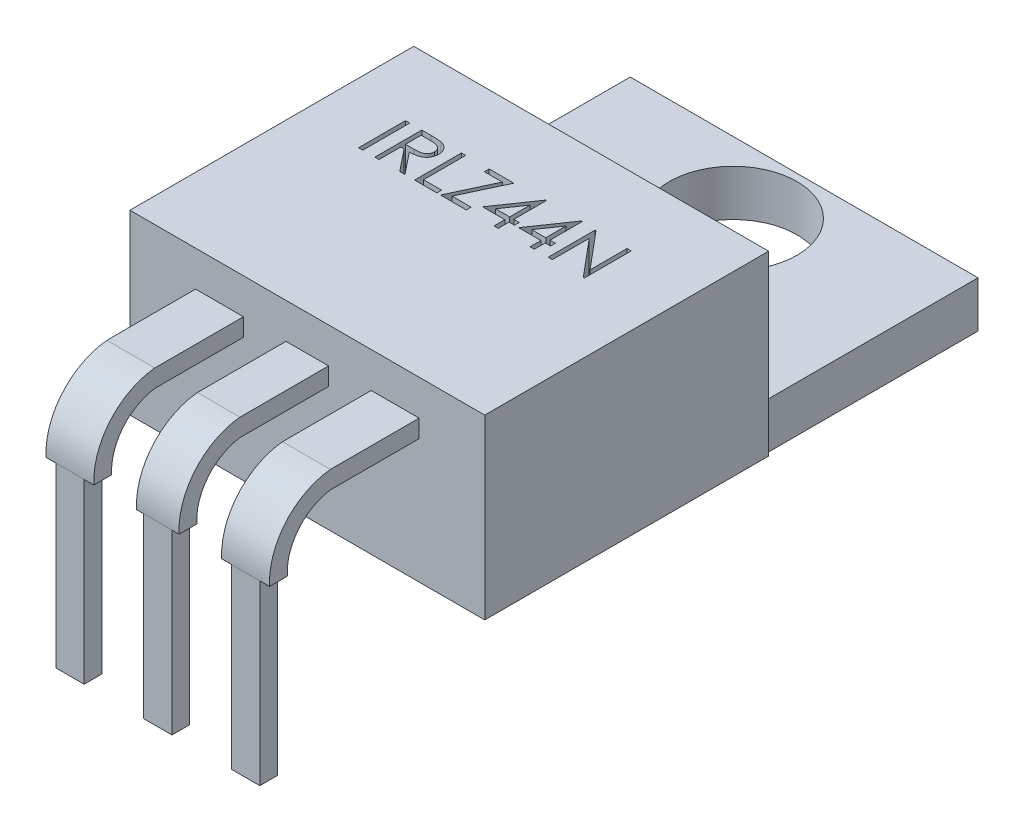
from build123d import *

# Parameters (mm, degrees)
SKETCH1_W           = 10
SKETCH1_H           = 8
BOSS_EXTRUDE1_DEPTH = 5
SKETCH2_W           = 9.8
SKETCH2_H           = 1.3
BOSS_EXTRUDE2_DEPTH = 6
SKETCH3_W           = 6.3
SKETCH3_H           = 0.5
BOSS_EXTRUDE3_DEPTH = 2.5
BOSS_EXTRUDE4_START = -6.3
BOSS_EXTRUDE4_DEPTH = 6.3
SKETCH5_W           = 1.2
SKETCH5_H           = 5
CUT_EXTRUDE1_DEPTH  = 14.190905958
SKETCH6_W           = 0.275
SKETCH6_H           = 5
SKETCH6_W_2         = 0.2
CUT_EXTRUDE2_DEPTH  = 3.5
SKETCH7_R           = 1.8
CUT_EXTRUDE3_DEPTH  = 3.5
SKETCH8_W           = 0.11872329
SKETCH8_H           = 1.322916667
CUT_EXTRUDE4_DEPTH  = 3.5


with BuildPart() as part:
    # Sketch1 → Boss-Extrude1 (new body)
    with BuildSketch(Plane(origin=(0, 0, 0), x_dir=(1, 0, 0), z_dir=(0, 1, 0))):
        Rectangle(SKETCH1_W, SKETCH1_H)
    extrude(amount=BOSS_EXTRUDE1_DEPTH)

    # Sketch2 → Boss-Extrude2 (add)
    with BuildSketch(Plane(origin=(0, 0, -4), x_dir=(-1, 0, 0), z_dir=(0, 0, -1))):
        with Locations((0, 0.65)):
            Rectangle(SKETCH2_W, SKETCH2_H)
    extrude(amount=BOSS_EXTRUDE2_DEPTH)

    # Sketch3 → Boss-Extrude3 (add)
    with BuildSketch(Plane.XY.offset(4)):
        with Locations((0, 3.75)):
            Rectangle(SKETCH3_W, SKETCH3_H)
    extrude(amount=BOSS_EXTRUDE3_DEPTH)

    # Sketch4 → Boss-Extrude4 (add)
    with BuildSketch(Plane.ZY.offset(3.15).offset(BOSS_EXTRUDE4_START)):
        with BuildLine():
            Line((7.714456463, 2), (7.714456463, -3))
            Line((7.714456463, -3), (8.214456463, -3))
            Line((8.214456463, -3), (8.214456463, 2))
            ThreePointArc((8.214456463, 2), (7.756212161, 3.342020289), (6.5, 4))
            Line((6.5, 4), (6.5, 3.5))
            ThreePointArc((6.5, 3.5), (7.40002744, 2.98706126), (7.714456463, 2))
        make_face()
    extrude(amount=BOSS_EXTRUDE4_DEPTH)

    # Sketch5 → Cut-Extrude1 (cut, through all)
    with BuildSketch(Plane(origin=(0, 4, 0), x_dir=(1, 0, 0), z_dir=(0, 1, 0))):
        with Locations((-1.2, -6.5)):
            Rectangle(SKETCH5_W, SKETCH5_H)
        with Locations((1.2, -6.5)):
            Rectangle(SKETCH5_W, SKETCH5_H)
    extrude(amount=-CUT_EXTRUDE1_DEPTH, mode=Mode.SUBTRACT)

    # Sketch6 → Cut-Extrude2 (cut)
    with BuildSketch(Plane.XY.offset(8.214456463)):
        with Locations((-3.0125, -0.5)):
            Rectangle(SKETCH6_W, SKETCH6_H)
        with Locations((-1.9375, -0.5)):
            Rectangle(SKETCH6_W, SKETCH6_H)
        with Locations((-0.5, -0.5)):
            Rectangle(SKETCH6_W_2, SKETCH6_H)
        with Locations((0.5, -0.5)):
            Rectangle(SKETCH6_W_2, SKETCH6_H)
        with Locations((1.9375, -0.5)):
            Rectangle(SKETCH6_W, SKETCH6_H)
        with Locations((3.0125, -0.5)):
            Rectangle(SKETCH6_W, SKETCH6_H)
    extrude(amount=-CUT_EXTRUDE2_DEPTH, mode=Mode.SUBTRACT)

    # Sketch7 → Cut-Extrude3 (cut)
    with BuildSketch(Plane(origin=(0, 1.3, 0), x_dir=(1, 0, 0), z_dir=(0, 1, 0))):
        with Locations(Location((0, 8, 0), (0, 0, 270))):
            Circle(SKETCH7_R)
    extrude(amount=-CUT_EXTRUDE3_DEPTH, mode=Mode.SUBTRACT)

    # Sketch8 → Cut-Extrude4 (cut)
    # profile 1 of 7: a face of its own
    with BuildSketch(Plane(origin=(0, 5, 0), x_dir=(1, 0, 0), z_dir=(0, 1, 0))):
        with Locations((-3.24297038, 1.408129396)):
            Rectangle(SKETCH8_W, SKETCH8_H)
    # profile 2 of 7: a face of its own
    with BuildSketch(Plane(origin=(0, 5, 0), x_dir=(1, 0, 0), z_dir=(0, 1, 0))):
        with BuildLine():
            Line((-2.844399333, 2.069587729), (-2.579656995, 2.069587729))
            add(Edge.make_bspline(
                [(-2.579656995, 2.069587729), (-2.561989961, 2.069528921), (-2.5280673, 2.069416003), (-2.479469665, 2.068786385), (-2.435311804, 2.066981792), (-2.395616805, 2.065428845), (-2.360385397, 2.06259707), (-2.329509546, 2.059890516), (-2.303131458, 2.056347495), (-2.287163532, 2.053057052), (-2.279933688, 2.051567229)],
                knots=[0, 0, 0, 0, 1.410062039, 2.707475311, 3.878576406, 4.937260626, 5.877586885, 6.699081471, 7.410979367, 8, 8, 8, 8], degree=3))
            add(Edge.make_bspline(
                [(-2.279933688, 2.051567229), (-2.270254994, 2.049175863), (-2.251104078, 2.044444144), (-2.22353069, 2.034443045), (-2.19725593, 2.022869555), (-2.172388943, 2.009276125), (-2.149054284, 1.993561849), (-2.127011351, 1.975998005), (-2.106160119, 1.956680698), (-2.087343849, 1.935122886), (-2.069602005, 1.91250611), (-2.054638446, 1.88804963), (-2.04173945, 1.862475184), (-2.031469641, 1.835522678), (-2.023200288, 1.807453496), (-2.017369537, 1.778013385), (-2.013872808, 1.747336469), (-2.013516809, 1.726412498), (-2.013336299, 1.715802923)],
                knots=[0, 0, 0, 0, 1.027469482, 2.033020251, 3.019912614, 3.986113645, 4.951240523, 5.91722682, 6.890402269, 7.87763091, 8.8651537, 9.85103654, 10.82876324, 11.815024772, 12.821070561, 13.842952187, 14.906261191, 16, 16, 16, 16], degree=3))
            add(Edge.make_bspline(
                [(-2.013336299, 1.715802923), (-2.013891545, 1.698175964), (-2.014974974, 1.663781201), (-2.025076427, 1.613865332), (-2.041622909, 1.567302704), (-2.064423676, 1.524151945), (-2.093459609, 1.485254172), (-2.128356182, 1.451088732), (-2.169132862, 1.422498646), (-2.207092753, 1.402672734), (-2.240624608, 1.389975415), (-2.268229461, 1.381041434), (-2.298341682, 1.374138846), (-2.330672758, 1.367955106), (-2.365357235, 1.363286459), (-2.402311982, 1.359867062), (-2.441563355, 1.357729966), (-2.468527824, 1.357411708), (-2.482399299, 1.357247985)],
                knots=[0, 0, 0, 0, 1.260483769, 2.459530307, 3.627416485, 4.787058657, 5.939039949, 7.08810263, 8.267026773, 9.491475466, 10.141966685, 10.831826277, 11.566392101, 12.351337768, 13.187381173, 14.07005841, 15.007169909, 16, 16, 16, 16], degree=3))
            Line((-2.482399299, 1.357247985), (-1.996375829, 0.746671062))
            Line((-1.996375829, 0.746671062), (-2.143189898, 0.746671062))
            Line((-2.143189898, 0.746671062), (-2.629213369, 1.357247985))
            Line((-2.629213369, 1.357247985), (-2.725676042, 1.357247985))
            Line((-2.725676042, 1.357247985), (-2.725676042, 0.746671062))
            Line((-2.725676042, 0.746671062), (-2.844399333, 0.746671062))
            Line((-2.844399333, 0.746671062), (-2.844399333, 2.069587729))
        make_face()
        with BuildLine():
            Line((-2.725676042, 1.933903968), (-2.725676042, 1.492931746))
            Line((-2.725676042, 1.492931746), (-2.483459329, 1.491076694))
            add(Edge.make_bspline(
                [(-2.483459329, 1.491076694), (-2.472150266, 1.491071691), (-2.450230083, 1.491061994), (-2.418517629, 1.492571546), (-2.388990087, 1.494288812), (-2.361760398, 1.496915499), (-2.336816398, 1.500300681), (-2.314170554, 1.504535143), (-2.2937859, 1.509468511), (-2.27001175, 1.517104245), (-2.243464014, 1.529201758), (-2.214612539, 1.546802408), (-2.190043203, 1.56894014), (-2.169285559, 1.594254512), (-2.152605685, 1.622087261), (-2.140846069, 1.652104758), (-2.133383896, 1.683549201), (-2.132503761, 1.705161164), (-2.132059589, 1.71606793)],
                knots=[0, 0, 0, 0, 1.146690395, 2.22261258, 3.21895312, 4.145990853, 4.996080663, 5.770904154, 6.481378293, 7.121626537, 8.300444488, 9.431385265, 10.535395872, 11.636531494, 12.74115979, 13.810798291, 14.895190096, 16, 16, 16, 16], degree=3))
            add(Edge.make_bspline(
                [(-2.132059589, 1.71606793), (-2.132513962, 1.726706665), (-2.133414364, 1.747788755), (-2.140765536, 1.778652745), (-2.153196939, 1.807782217), (-2.169949689, 1.835058675), (-2.190360084, 1.859818283), (-2.21429271, 1.881002772), (-2.241093185, 1.898483969), (-2.26614212, 1.909654821), (-2.288531242, 1.916503694), (-2.307970429, 1.921323331), (-2.329935184, 1.925195496), (-2.354532158, 1.928297947), (-2.381656346, 1.930964548), (-2.411444896, 1.932760608), (-2.443700167, 1.933824181), (-2.466056299, 1.933876754), (-2.477629167, 1.933903968)],
                knots=[0, 0, 0, 0, 1.101028733, 2.181837193, 3.264309656, 4.369019818, 5.486613113, 6.575447106, 7.666700264, 8.788928104, 9.402425223, 10.0903467, 10.862060571, 11.710948788, 12.657782767, 13.684531032, 14.801375019, 16, 16, 16, 16], degree=3))
            Line((-2.477629167, 1.933903968), (-2.725676042, 1.933903968))
        make_face(mode=Mode.SUBTRACT)
    # profile 3 of 7: a face of its own
    with BuildSketch(Plane(origin=(0, 5, 0), x_dir=(1, 0, 0), z_dir=(0, 1, 0))):
        Polygon((-1.725008307, 2.069587729), (-1.606285017, 2.069587729), (-1.606285017, 0.882354823), (-1.097470914, 0.882354823), (-1.097470914, 0.746671062), (-1.725008307, 0.746671062), align=None)
    # profile 4 of 7: a face of its own
    with BuildSketch(Plane(origin=(0, 5, 0), x_dir=(1, 0, 0), z_dir=(0, 1, 0))):
        Polygon((-0.944826683, 1.933903968), (-0.944826683, 2.069587729), (-0.24944741, 2.069587729), (-0.80437279, 0.882354823), (-0.26640788, 0.882354823), (-0.26640788, 0.746671062), (-0.995708093, 0.746671062), (-0.440782713, 1.933903968), align=None)
    # profile 5 of 7: a face of its own
    with BuildSketch(Plane(origin=(0, 5, 0), x_dir=(1, 0, 0), z_dir=(0, 1, 0))):
        Polygon((0.608381366, 2.103508669), (0.632497035, 2.103508669), (0.632497035, 1.187643284), (0.785141265, 1.187643284), (0.785141265, 1.051959524), (0.632497035, 1.051959524), (0.632497035, 0.746671062), (0.513773744, 0.746671062), (0.513773744, 1.051959524), (-0.113763649, 1.051959524), align=None)
        Polygon((0.513773744, 1.187643284), (0.513773744, 1.762179208), (0.119442815, 1.187643284), align=None, mode=Mode.SUBTRACT)
    # profile 6 of 7: a face of its own
    with BuildSketch(Plane(origin=(0, 5, 0), x_dir=(1, 0, 0), z_dir=(0, 1, 0))):
        Polygon((1.626009571, 2.103508669), (1.65012524, 2.103508669), (1.65012524, 1.187643284), (1.802769471, 1.187643284), (1.802769471, 1.051959524), (1.65012524, 1.051959524), (1.65012524, 0.746671062), (1.531401949, 0.746671062), (1.531401949, 1.051959524), (0.903864556, 1.051959524), align=None)
        Polygon((1.531401949, 1.187643284), (1.531401949, 1.762179208), (1.13707102, 1.187643284), align=None, mode=Mode.SUBTRACT)
    # profile 7 of 7: a face of its own
    with BuildSketch(Plane(origin=(0, 5, 0), x_dir=(1, 0, 0), z_dir=(0, 1, 0))):
        Polygon((2.040216052, 0.746671062), (2.040216052, 2.069587729), (2.065126742, 2.069587729), (2.939120966, 1.02837387), (2.939120966, 2.069587729), (3.057844257, 2.069587729), (3.057844257, 0.746671062), (3.030813508, 0.746671062), (2.158939342, 1.785499855), (2.158939342, 0.746671062), align=None)
    extrude(amount=-CUT_EXTRUDE4_DEPTH, mode=Mode.SUBTRACT)


solid = part.part
